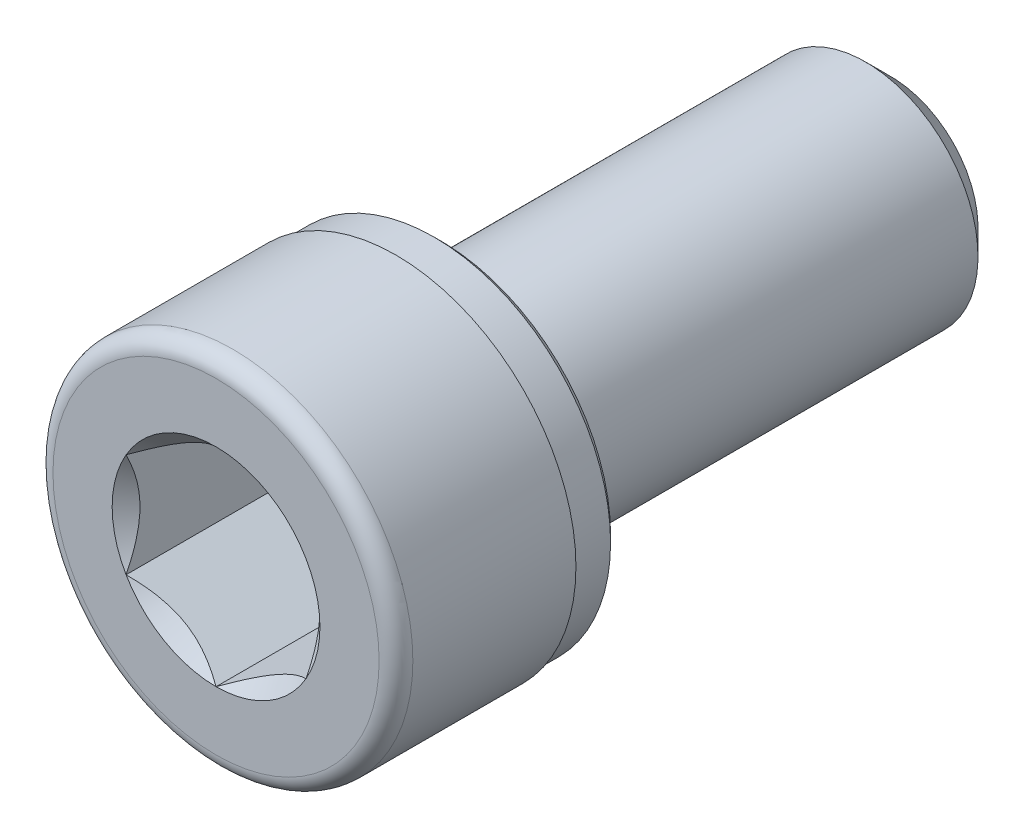
from build123d import *

# Parameters (mm, degrees)
CHAMFER1_SIZE      = 1.125
SKETCH3_OUTSIDE_W  = 25.516
SKETCH3_OUTSIDE_H  = 25.516
SKETCH3_OUTSIDE_R  = 7.84
CUT_EXTRUDE1_DEPTH = 2
CHAMFER2_SIZE      = 0.3
FILLET1_R          = 0.75
SKETCH4_R          = 0.9
SKETCH14_R         = 0.9
CUT_EXTRUDE2_DEPTH = 7.5
SKETCH6_R          = 4.618802154
CUT_EXTRUDE3_DEPTH = 2.54
CUT_EXTRUDE3_DRAFT = -45


with BuildPart() as part:
    # Sketch2 → Revolve1 (revolve)
    with BuildSketch(Plane(origin=(0, 0, 0), x_dir=(0, 0, -1), z_dir=(1, 0, 0)), mode=Mode.PRIVATE) as revolve1_sk:
        Polygon((-15, 8), (-15, 0), (15, 0), (15, 5), (-5, 5), (-5, 8), align=None)
    revolve(revolve1_sk.sketch.rotate(Axis((0, 0, 15), (0, 0, -1)), 180), axis=Axis((0, 0, 15), (0, 0, -1)))

    # Chamfer1
    chamfer1_edges = [part.edges().sort_by_distance(p)[0] for p in [
        (0, 5, -15),
    ]]
    chamfer(chamfer1_edges, length=CHAMFER1_SIZE)

    # Sketch3 outside → Cut-Extrude1 (cut)
    with BuildSketch(Plane(origin=(0, 0, 5), x_dir=(-1, 0, 0), z_dir=(0, 0, -1))):
        Rectangle(SKETCH3_OUTSIDE_W, SKETCH3_OUTSIDE_H)
        Circle(SKETCH3_OUTSIDE_R, mode=Mode.SUBTRACT)
    extrude(amount=-CUT_EXTRUDE1_DEPTH, mode=Mode.SUBTRACT)

    # Chamfer2
    chamfer2_edges = [part.edges().sort_by_distance(p)[0] for p in [
        (7.84, 0, 5),
    ]]
    chamfer(chamfer2_edges, length=CHAMFER2_SIZE)

    # Fillet1
    fillet1_edges = [part.edges().sort_by_distance(p)[0] for p in [
        (0, 8, 15),
    ]]
    fillet(fillet1_edges, radius=FILLET1_R)

    # Sketch14 → Cut-Revolve1 (revolve, cut)
    with BuildSketch(Plane(origin=(0, 0, 0), x_dir=(0, 0, -1), z_dir=(1, 0, 0))):
        with Locations((-5, 5.9)):
            Circle(SKETCH14_R)
    revolve(axis=Axis((0, 0, 15), (0, 0, -1)), mode=Mode.SUBTRACT)

    # Sketch5 → Cut-Extrude2 (cut)
    with BuildSketch(Plane.XY.offset(15)):
        Polygon((0, 4.618802154), (-4, 2.309401077), (-4, -2.309401077), (0, -4.618802154), (4, -2.309401077), (4, 2.309401077), align=None)
    extrude(amount=-CUT_EXTRUDE2_DEPTH, mode=Mode.SUBTRACT)


with BuildPart() as body_2:
    # Sketch4 → Revolve2 (revolve)
    with BuildSketch(Plane(origin=(0, 0, 0), x_dir=(0, 0, -1), z_dir=(1, 0, 0))):
        with Locations((-5, 5.9)):
            Circle(SKETCH4_R)
    revolve(axis=Axis((0, 0, 15), (0, 0, -1)))


with BuildPart() as cut_extrude3_tool:
    # Sketch6 → Cut-Extrude3 (with draft: the straight prism first)
    with BuildSketch(Plane.XY.offset(15)):
        Circle(SKETCH6_R)
    extrude(amount=-CUT_EXTRUDE3_DEPTH)
    # Cut-Extrude3: the draft: its side faces are tilted about the plane it starts from
    cut_extrude3_sides = [cut_extrude3_tool.faces().sort_by_distance(p)[0] for p in [
        (-4.618802154, 0, 13.73),
    ]]
    draft(cut_extrude3_sides, Plane.XY.offset(15), CUT_EXTRUDE3_DRAFT)


with BuildPart() as part_1:
    add(part.part)

    # Cut-Extrude3: cut by cut_extrude3_tool
    add(cut_extrude3_tool.part, mode=Mode.SUBTRACT)


solid = Compound([body_2.part, part_1.part])
